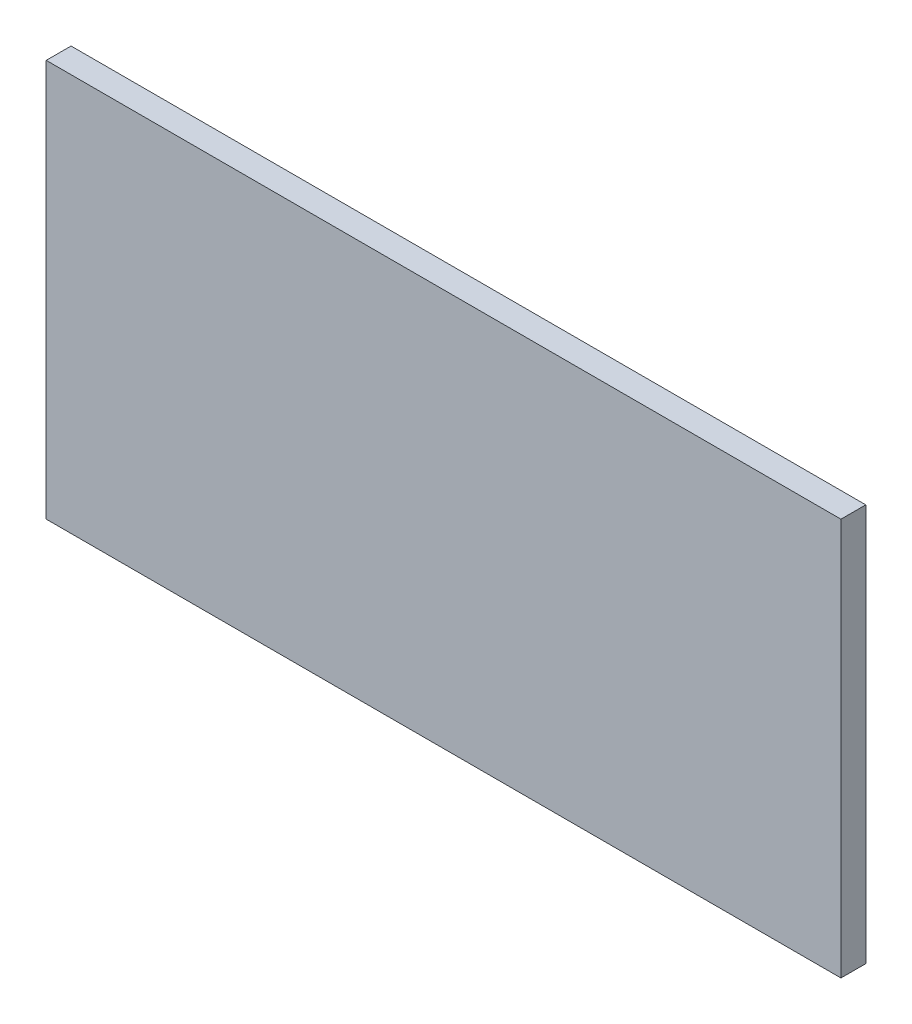
from build123d import *

# Parameters (mm, degrees)
SKETCH1_W           = 101.6
SKETCH1_H           = 50.8
BOSS_EXTRUDE1_DEPTH = 3.175


with BuildPart() as part:
    # Sketch1 → Boss-Extrude1 (new body)
    with BuildSketch(Plane.XY):
        with Locations((50.8, -25.4)):
            Rectangle(SKETCH1_W, SKETCH1_H)
    extrude(amount=BOSS_EXTRUDE1_DEPTH)


solid = part.part
